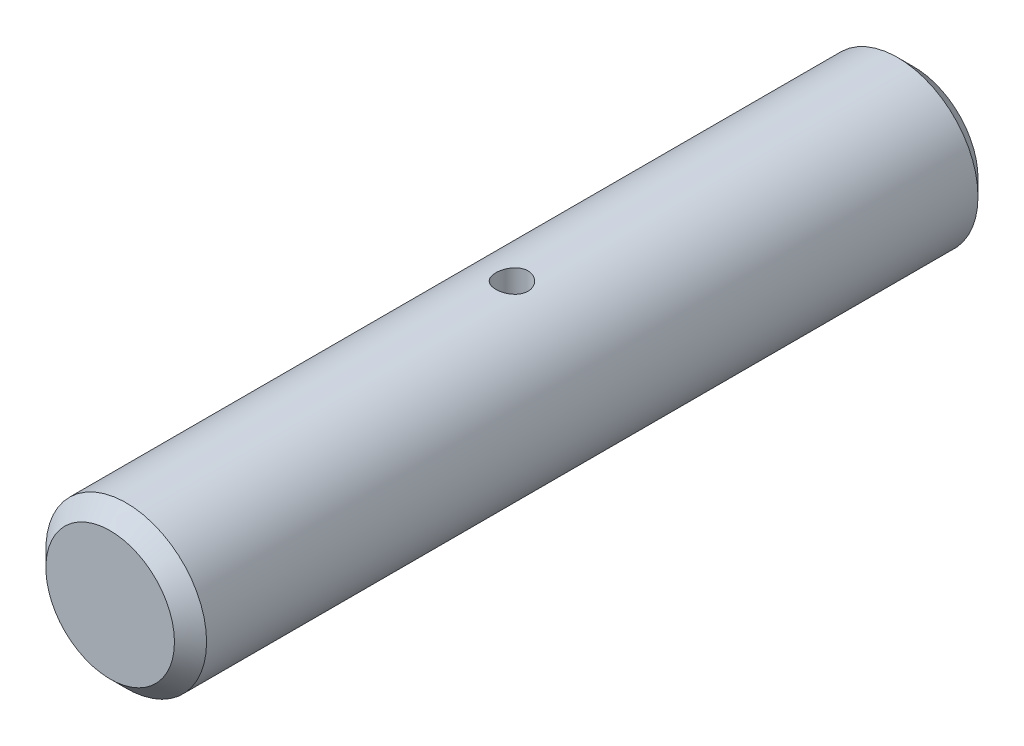
from build123d import *

# Parameters (mm, degrees)
SKETCH_1_R               = 5
EXTRUDE_1_DEPTH          = 25
CHAMFER_1_SIZE           = 1
CUT_EXTRUDE_1_DEPTH      = 26.980762114
CUT_EXTRUDE_1_DEPTH_BACK = 26.980762114
SKETCH_2_R               = 1


with BuildPart() as part:
    # 草图1 → 凸台-拉伸1 (new, symmetric)
    with BuildSketch(Plane.XY):
        Circle(SKETCH_1_R)
    extrude(amount=EXTRUDE_1_DEPTH, both=True)

    # 倒角1
    chamfer_1_edges = [part.edges().sort_by_distance(p)[0] for p in [
        (-5, 0, -25),
        (-5, 0, 25),
    ]]
    chamfer(chamfer_1_edges, length=CHAMFER_1_SIZE)

    # 草图2 → 切除-拉伸1 (cut, two sides: drawn at the far end of the back side and taken through both)
    with BuildSketch(Plane(origin=(0, 0, 0), x_dir=(1, 0, 0), z_dir=(0, 1, 0)).offset(-CUT_EXTRUDE_1_DEPTH_BACK)):
        with Locations(Location((0, 0, 0), (0, 0, 270))):
            Circle(SKETCH_2_R)
    extrude(amount=CUT_EXTRUDE_1_DEPTH + CUT_EXTRUDE_1_DEPTH_BACK, mode=Mode.SUBTRACT)


solid = part.part
